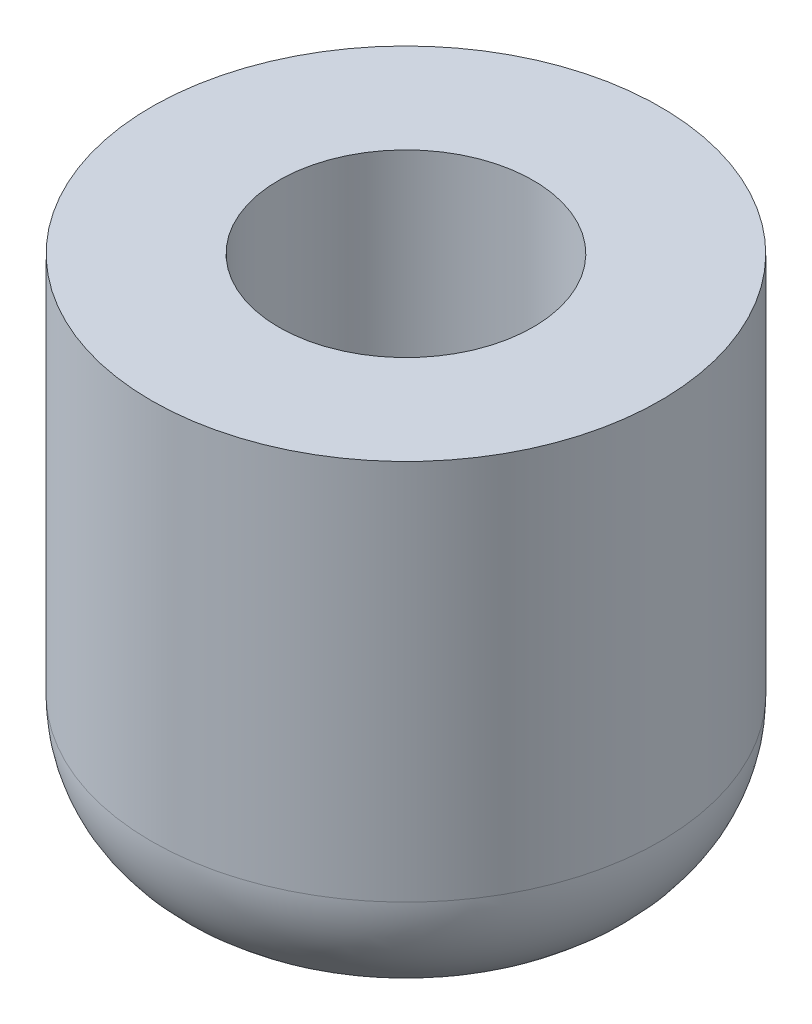
from build123d import *

# Parameters (mm, degrees)
SKETCH1_R           = 6.35
BOSS_EXTRUDE1_DEPTH = 6.35
SKETCH2_R           = 3.175
CUT_EXTRUDE1_DEPTH  = 6.35
FILLET1_R           = 3.175


with BuildPart() as part:
    # Sketch1 → Boss-Extrude1 (new, symmetric)
    with BuildSketch(Plane(origin=(0, 0, 0), x_dir=(1, 0, 0), z_dir=(0, 1, 0))):
        with Locations(Location((0, 0, 0), (0, 0, 270))):
            Circle(SKETCH1_R)
    extrude(amount=BOSS_EXTRUDE1_DEPTH, both=True)

    # Sketch2 → Cut-Extrude1 (cut)
    with BuildSketch(Plane(origin=(0, 6.35, 0), x_dir=(1, 0, 0), z_dir=(0, 1, 0))):
        with Locations(Location((0, 0, 0), (0, 0, 270))):
            Circle(SKETCH2_R)
    extrude(amount=-CUT_EXTRUDE1_DEPTH, mode=Mode.SUBTRACT)

    # Fillet1
    fillet1_edges = [part.edges().sort_by_distance(p)[0] for p in [
        (0, -6.35, -6.35),
    ]]
    fillet(fillet1_edges, radius=FILLET1_R)


solid = part.part
